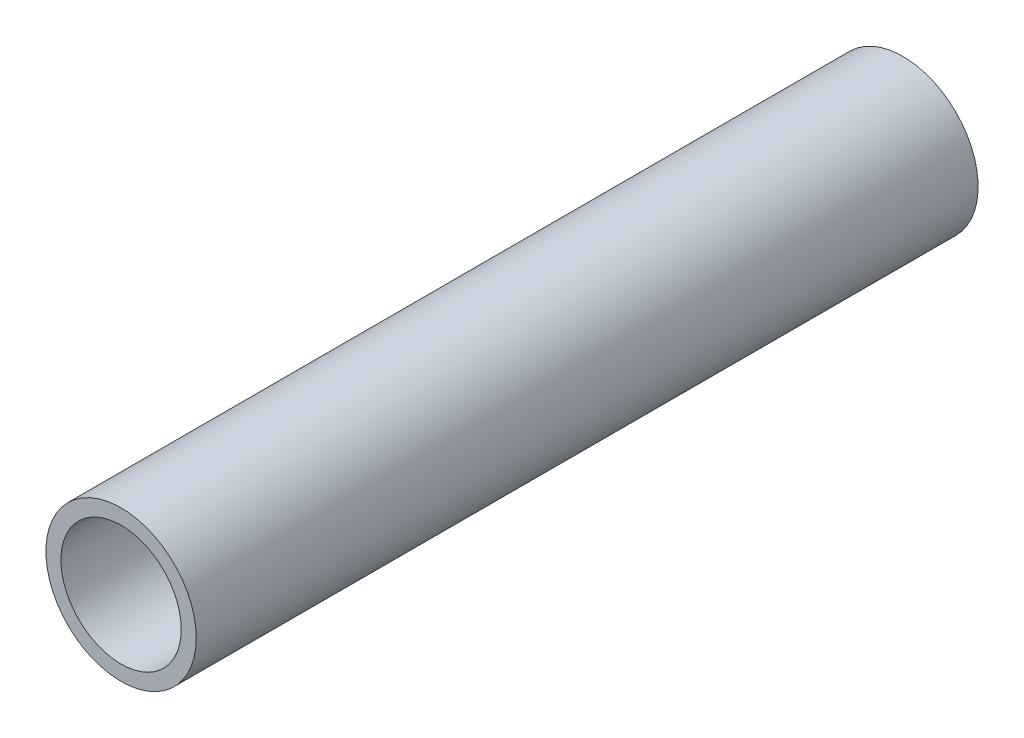
from build123d import *

# Parameters (mm, degrees)
ESBO_O1_R                  = 12.5
ESBO_O1_R_2                = 10
RESSALTO_EXTRUS_O1_DEPTH   = 130
CORTE_EXTRUS_O1_DEPTH      = 5
CORTE_EXTRUS_O1_DEPTH_BACK = 5
ESBO_O2_R                  = 12.5
ESBO_O2_R_2                = 12


with BuildPart() as part:
    # Esboço1 → Ressalto-extrusão1 (new body)
    with BuildSketch(Plane.XY):
        Circle(ESBO_O1_R)
        Circle(ESBO_O1_R_2, mode=Mode.SUBTRACT)
    extrude(amount=RESSALTO_EXTRUS_O1_DEPTH)

    # Esboço2 → Corte-extrusão1 (cut, two sides: drawn at the far end of the back side and taken through both)
    with BuildSketch(Plane(origin=(0, 0, 0), x_dir=(0, 0, -1), z_dir=(1, 0, 0)).offset(-CORTE_EXTRUS_O1_DEPTH_BACK)):
        with Locations((5, 0)):
            Circle(ESBO_O2_R)
        with Locations((5, 0)):
            Circle(ESBO_O2_R_2, mode=Mode.SUBTRACT)
    extrude(amount=CORTE_EXTRUS_O1_DEPTH + CORTE_EXTRUS_O1_DEPTH_BACK, mode=Mode.SUBTRACT)


solid = part.part
